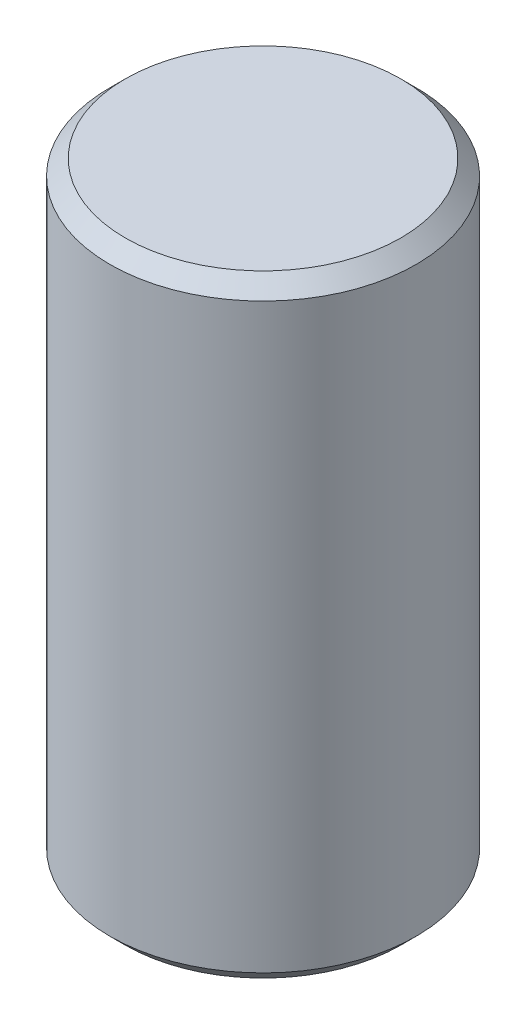
from build123d import *

# Parameters (mm, degrees)
SKETCH1_R           = 1
BOSS_EXTRUDE1_DEPTH = 4
CHAMFER1_SIZE       = 0.1


with BuildPart() as part:
    # Sketch1 → Boss-Extrude1 (new body)
    with BuildSketch(Plane(origin=(0, 0, 0), x_dir=(1, 0, 0), z_dir=(0, 1, 0))):
        with Locations(Location((0, 0, 0), (0, 0, 270))):
            Circle(SKETCH1_R)
    extrude(amount=BOSS_EXTRUDE1_DEPTH)

    # Chamfer1
    chamfer1_edges = [part.edges().sort_by_distance(p)[0] for p in [
        (0, 0, -1),
        (0, 4, -1),
    ]]
    chamfer(chamfer1_edges, length=CHAMFER1_SIZE)


solid = part.part
